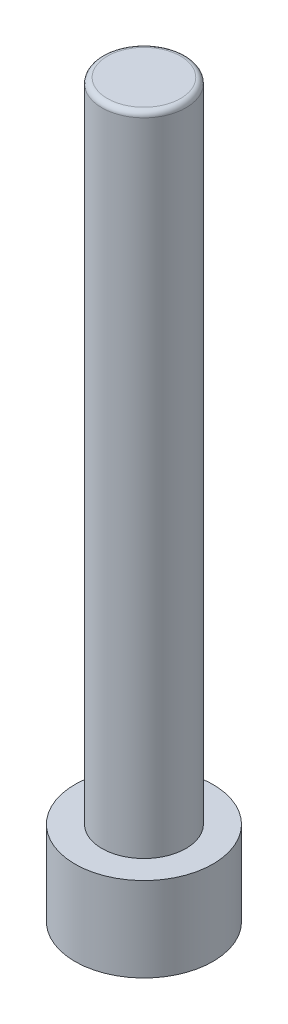
from build123d import *

# Parameters (mm, degrees)
SKETCH1_R           = 6.4
BOSS_EXTRUDE1_DEPTH = 67.83
SKETCH2_OUTSIDE_W   = 28.84
SKETCH2_OUTSIDE_H   = 28.84
SKETCH2_OUTSIDE_R   = 3.9
CUT_EXTRUDE1_DEPTH  = 60
CUT_EXTRUDE2_DEPTH  = 5.64
FILLET1_R           = 0.5


with BuildPart() as part:
    # Sketch1 → Boss-Extrude1 (new body)
    with BuildSketch(Plane(origin=(0, 0, 0), x_dir=(1, 0, 0), z_dir=(0, 1, 0))):
        with Locations(Location((0, 0, 0), (0, 0, 270))):
            Circle(SKETCH1_R)
    extrude(amount=BOSS_EXTRUDE1_DEPTH)

    # Sketch2 outside → Cut-Extrude1 (cut)
    with BuildSketch(Plane(origin=(0, 67.83, 0), x_dir=(1, 0, 0), z_dir=(0, 1, 0))):
        Rectangle(SKETCH2_OUTSIDE_W, SKETCH2_OUTSIDE_H)
        with Locations(Location((0, 0, 0), (0, 0, 270))):
            Circle(SKETCH2_OUTSIDE_R, mode=Mode.SUBTRACT)
    extrude(amount=-CUT_EXTRUDE1_DEPTH, mode=Mode.SUBTRACT)

    # Sketch8 → Cut-Extrude2 (cut)
    with BuildSketch(Plane.XZ):
        Polygon((3.464101615, 0), (1.732050808, 3), (-1.732050808, 3), (-3.464101615, 0), (-1.732050808, -3), (1.732050808, -3), align=None)
    extrude(amount=-CUT_EXTRUDE2_DEPTH, mode=Mode.SUBTRACT)

    # Fillet1
    fillet1_edges = [part.edges().sort_by_distance(p)[0] for p in [
        (0, 67.83, -3.9),
    ]]
    fillet(fillet1_edges, radius=FILLET1_R)


solid = part.part
